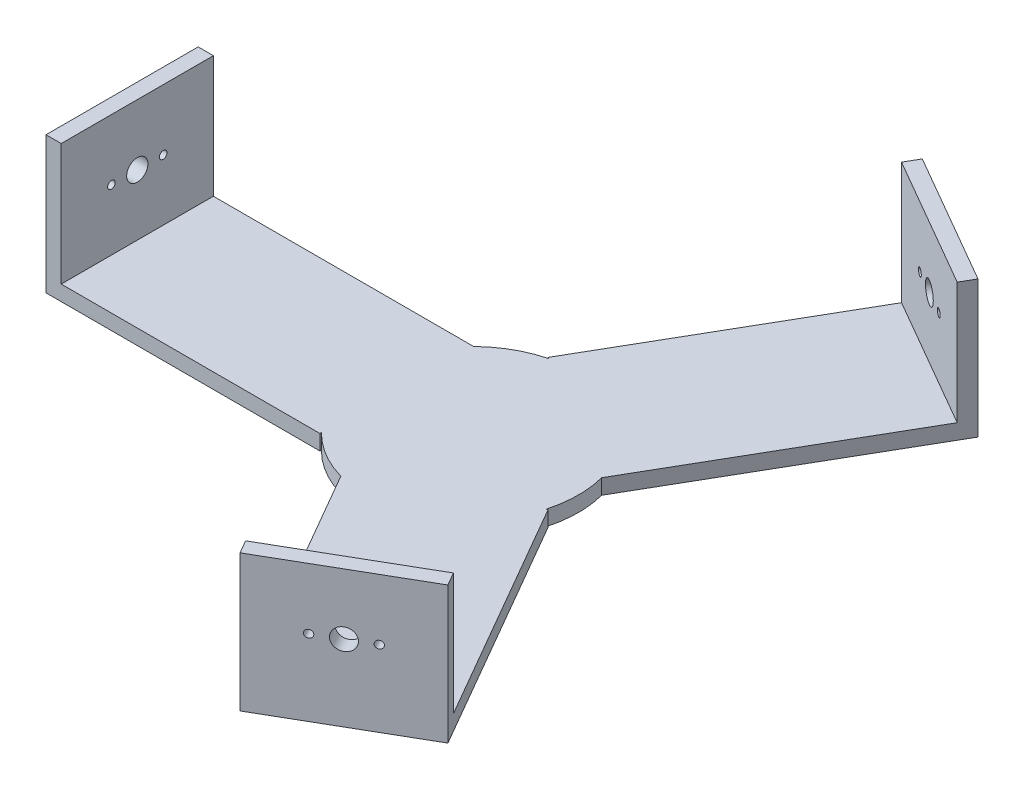
from build123d import *

# Parameters (mm, degrees)
BOSS_EXTRU_3_DEPTH      = 5
ESQUISSE4_W             = 5
ESQUISSE4_H             = 50
BOSS_EXTRU_4_DEPTH      = 40
ESQUISSE5_R             = 3.5
ESQUISSE5_R_2           = 1.25
ENL_V_MAT_EXTRU_1_DEPTH = 225.427684996
ESQUISSE6_R             = 3.5
ESQUISSE6_R_2           = 1.25
ENL_V_MAT_EXTRU_2_DEPTH = 272.884889055
ESQUISSE7_R             = 3.5
ESQUISSE7_R_2           = 1.25
ENL_V_MAT_EXTRU_3_DEPTH = 272.884889055


with BuildPart() as part:
    # Esquisse3 → Boss.-Extru.3 (new body)
    with BuildSketch(Plane(origin=(0, 0, 0), x_dir=(1, 0, 0), z_dir=(0, 1, 0))):
        with BuildLine():
            Line((-115, -25), (-25, -25))
            Line((-25, -25), (-24.99494949, -24.500051021))
            ThreePointArc((-24.99494949, -24.500051021), (-17.805293657, -30.132565736), (-9.403186381, -33.713203436))
            Line((-9.403186381, -33.713203436), (35.849364905, -112.092921435))
            Line((35.849364905, -112.092921435), (79.150635095, -87.092921435))
            Line((79.150635095, -87.092921435), (34.150635095, -9.150635095))
            Line((34.150635095, -9.150635095), (33.715141323, -9.396235714))
            ThreePointArc((33.715141323, -9.396235714), (34.998214236, -0.353553761), (33.898083809, 8.713203436))
            Line((33.898083809, 8.713203436), (79.150635095, 87.092921435))
            Line((79.150635095, 87.092921435), (35.849364905, 112.092921435))
            Line((35.849364905, 112.092921435), (-9.150635095, 34.150635095))
            Line((-9.150635095, 34.150635095), (-8.720191833, 33.896286735))
            ThreePointArc((-8.720191833, 33.896286735), (-17.19292058, 30.486119496), (-24.494897428, 25))
            Line((-24.494897428, 25), (-115, 25))
            Line((-115, 25), (-115, -25))
        make_face()
    extrude(amount=BOSS_EXTRU_3_DEPTH)

    # Esquisse4 → Boss.-Extru.4 (add)
    with BuildSketch(Plane(origin=(0, 5, 0), x_dir=(1, 0, 0), z_dir=(0, 1, 0))):
        with Locations((-112.5, 0)):
            Rectangle(ESQUISSE4_W, ESQUISSE4_H)
        Polygon((35.849364905, 112.092921435), (79.150635095, 87.092921435), (76.650635095, 82.762794416), (33.349364905, 107.762794416), align=None)
        Polygon((79.150635095, -87.092921435), (76.650635095, -82.762794416), (33.349364905, -107.762794416), (35.849364905, -112.092921435), align=None)
    extrude(amount=BOSS_EXTRU_4_DEPTH)

    # Esquisse5 → Enlèv. mat.-Extru.1 (cut, through all)
    with BuildSketch(Plane(origin=(-110, 0, 0), x_dir=(0, 0, -1), z_dir=(1, 0, 0))):
        with Locations((0, 25)):
            Circle(ESQUISSE5_R)
        with Locations((-8.5, 25)):
            Circle(ESQUISSE5_R_2)
        with Locations((8.5, 25)):
            Circle(ESQUISSE5_R_2)
    extrude(amount=-ENL_V_MAT_EXTRU_1_DEPTH, mode=Mode.SUBTRACT)

    # Esquisse6 → Enlèv. mat.-Extru.2 (cut, through all)
    with BuildSketch(Plane(origin=(55, 0, 95.262794416), x_dir=(-0.8660254037844386, 0, 0.4999999999999999), z_dir=(-0.49999999999999994, 0, -0.8660254037844387))):
        with Locations((0, 25)):
            Circle(ESQUISSE6_R)
        with Locations((-8.5, 25)):
            Circle(ESQUISSE6_R_2)
        with Locations((8.5, 25)):
            Circle(ESQUISSE6_R_2)
    extrude(amount=-ENL_V_MAT_EXTRU_2_DEPTH, mode=Mode.SUBTRACT)

    # Esquisse7 → Enlèv. mat.-Extru.3 (cut, through all)
    with BuildSketch(Plane(origin=(55, 0, -95.262794416), x_dir=(0.8660254037844388, 0, 0.49999999999999983), z_dir=(-0.4999999999999998, 0, 0.8660254037844387))):
        with Locations((0, 25)):
            Circle(ESQUISSE7_R)
        with Locations((8.5, 25)):
            Circle(ESQUISSE7_R_2)
        with Locations((-8.5, 25)):
            Circle(ESQUISSE7_R_2)
    extrude(amount=-ENL_V_MAT_EXTRU_3_DEPTH, mode=Mode.SUBTRACT)


solid = part.part
